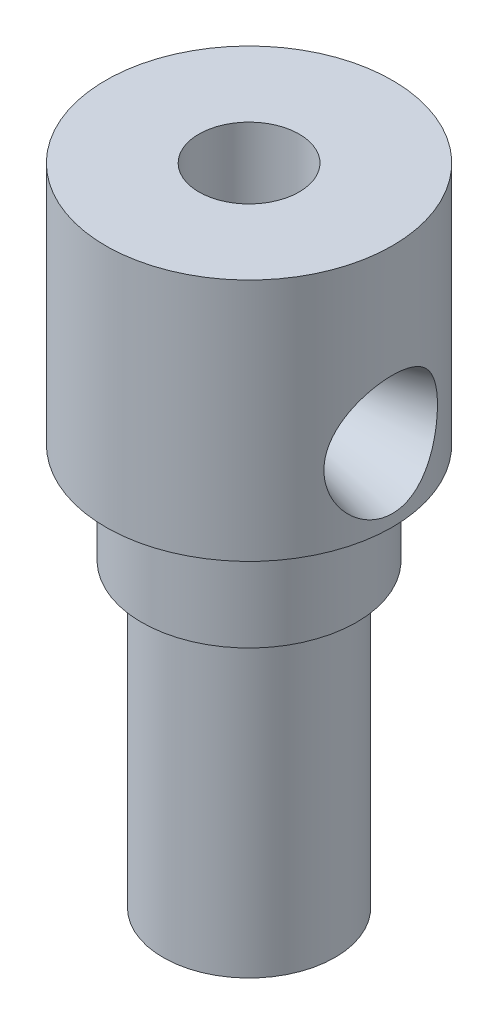
from build123d import *

# Parameters (mm, degrees)
CUT_EXTRUDE2_START      = -8
CUT_EXTRUDE2_DEPTH      = 10
CUT_EXTRUDE3_REACH      = 51.487
CUT_EXTRUDE3_END_RADIUS = 3.5
SKETCH3_R               = 1.5
SKETCH4_R               = 1.5
CUT_EXTRUDE5_DEPTH      = 10
CUT_EXTRUDE5_DRAFT      = -15


with BuildPart() as part:
    # Sketch1 → Revolve1 (revolve)
    with BuildSketch(Plane.XY):
        Polygon((3.5, 0), (6, 0), (6, 21), (7.5, 21), (7.5, 28), (10, 28), (10, 45), (3.5, 45), align=None)
    revolve(axis=Axis((0, -1000, 0), (0, 1, 0)))

    # Sketch2 → Cut-Extrude2 (cut)
    with BuildSketch(Plane(origin=(0, 0, 0), x_dir=(0, 0, -1), z_dir=(1, 0, 0)).offset(CUT_EXTRUDE2_START)):
        with BuildLine():
            Line((2, 40), (2, 33))
            ThreePointArc((2, 33), (0, 31), (-2, 33))
            Line((-2, 33), (-2, 40))
            ThreePointArc((-2, 40), (0, 42), (2, 40))
        make_face()
    extrude(amount=-CUT_EXTRUDE2_DEPTH, mode=Mode.SUBTRACT)

    # Cut-Extrude3: up to this cylinder (the profile starts outside it)
    cut_extrude3_end = Plane(origin=(0, 33, 0), z_dir=(0, -1, 0)) * Cylinder(CUT_EXTRUDE3_END_RADIUS, 110.974, mode=Mode.PRIVATE)
    # Sketch3 → Cut-Extrude3 (cut, up to the surface)
    with BuildSketch(Plane.ZY.offset(8), mode=Mode.PRIVATE) as cut_extrude3_sk1:
        with Locations((0, 33)):
            Circle(SKETCH3_R)
    cut_extrude3_tool1 = extrude(cut_extrude3_sk1.sketch, amount=-CUT_EXTRUDE3_REACH, mode=Mode.PRIVATE) - cut_extrude3_end
    add(cut_extrude3_tool1.solids().sort_by_distance((-8, 33, 0))[0], mode=Mode.SUBTRACT)


with BuildPart() as cut_extrude5_tool:
    # Sketch4 → Cut-Extrude5 (with draft: the straight prism first)
    with BuildSketch(Plane(origin=(0, 0, 0), x_dir=(0, 0, -1), z_dir=(1, 0, 0))):
        with Locations(Location((0, 33, 0), (0, 0, 180))):
            Circle(SKETCH4_R)
    extrude(amount=CUT_EXTRUDE5_DEPTH)
    # Cut-Extrude5: the draft: its side faces are tilted about the plane it starts from
    cut_extrude5_sides = [cut_extrude5_tool.faces().sort_by_distance(p)[0] for p in [
        (5, 33, -1.5),
    ]]
    draft(cut_extrude5_sides, Plane(origin=(0, 0, 0), x_dir=(0, 0, -1), z_dir=(1, 0, 0)), CUT_EXTRUDE5_DRAFT)


with BuildPart() as part_1:
    add(part.part)

    # Cut-Extrude5: cut by cut_extrude5_tool
    add(cut_extrude5_tool.part, mode=Mode.SUBTRACT)


solid = part_1.part
